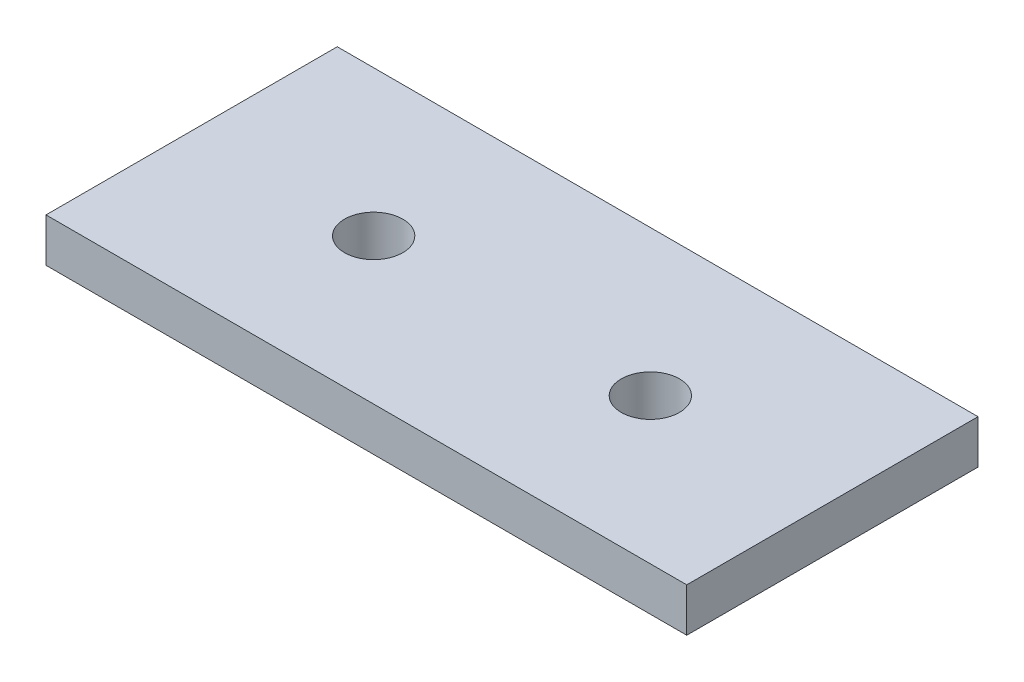
from build123d import *

# Parameters (mm, degrees)
SKETCH1_W           = 88
SKETCH1_H           = 40
BOSS_EXTRUDE1_DEPTH = 6
SKETCH3_R           = 4
CUT_EXTRUDE1_DEPTH  = 6


with BuildPart() as part:
    # Sketch1 → Boss-Extrude1 (new body)
    with BuildSketch(Plane(origin=(0, 0, 0), x_dir=(1, 0, 0), z_dir=(0, 1, 0))):
        with Locations((-93.941176471, -10.441176471)):
            Rectangle(SKETCH1_W, SKETCH1_H)
    extrude(amount=BOSS_EXTRUDE1_DEPTH)

    # Sketch3 → Cut-Extrude1 (cut)
    with BuildSketch(Plane.XZ):
        with Locations(Location((-74.941176471, 10.441176471, 0), (0, 0, 270))):
            Circle(SKETCH3_R)
        with Locations(Location((-112.941176471, 10.441176471, 0), (0, 0, 270))):
            Circle(SKETCH3_R)
    extrude(amount=-CUT_EXTRUDE1_DEPTH, mode=Mode.SUBTRACT)


solid = part.part
